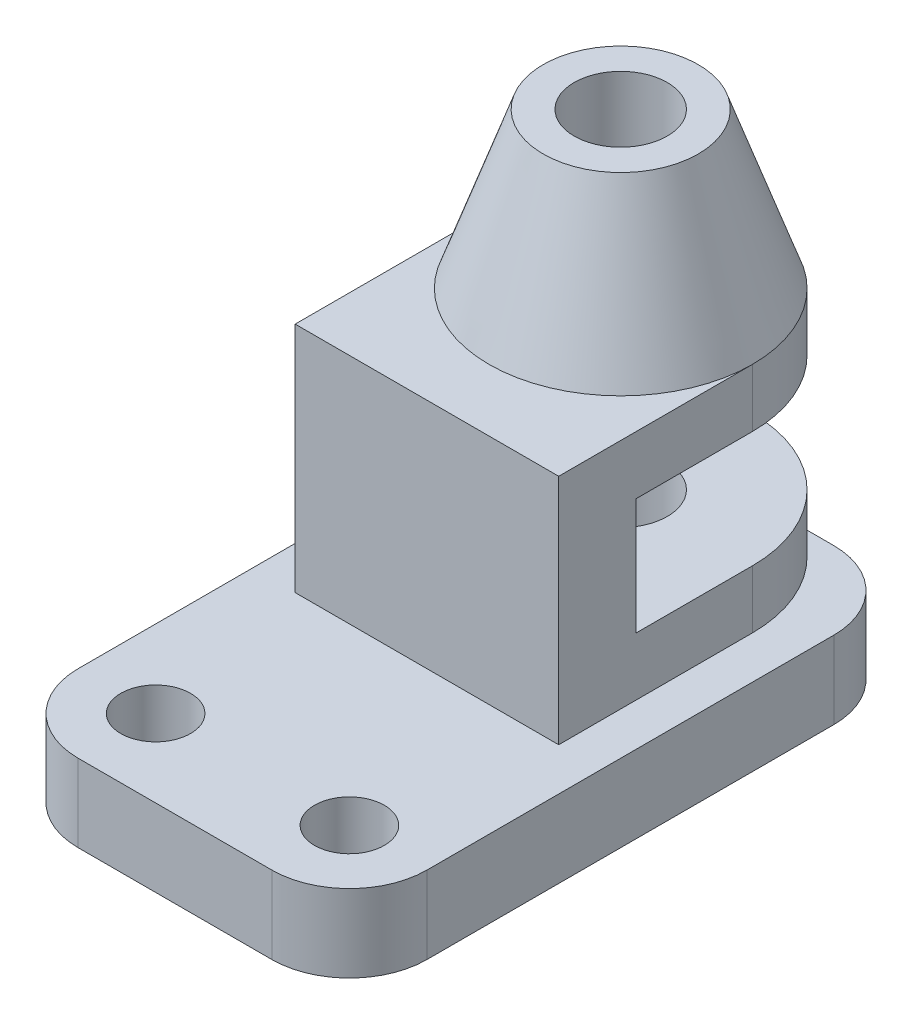
from build123d import *

# Parameters (mm, degrees)
SKETCH1_R           = 9
BOSS_EXTRUDE1_DEPTH = 20
BOSS_EXTRUDE4_DEPTH = 60
CUT_EXTRUDE1_START  = -45
CUT_EXTRUDE1_DEPTH  = 30
SKETCH9_R           = 12
CUT_EXTRUDE2_DEPTH  = 150.255653159


with BuildPart() as part:
    # Sketch1 → Boss-Extrude1 (new body)
    with BuildSketch(Plane(origin=(0, 0, 0), x_dir=(1, 0, 0), z_dir=(0, 1, 0))):
        with BuildLine():
            Line((-25, -72.5), (25, -72.5))
            ThreePointArc((25, -72.5), (39.142135624, -66.642135624), (45, -52.5))
            Line((45, -52.5), (45, 52.5))
            ThreePointArc((45, 52.5), (39.142135624, 66.642135624), (25, 72.5))
            Line((25, 72.5), (-25, 72.5))
            ThreePointArc((-25, 72.5), (-39.142135624, 66.642135624), (-45, 52.5))
            Line((-45, 52.5), (-45, -52.5))
            ThreePointArc((-45, -52.5), (-39.142135624, -66.642135624), (-25, -72.5))
        make_face()
        with Locations(Location((25, -52.5, 0), (0, 0, 270))):
            Circle(SKETCH1_R, mode=Mode.SUBTRACT)
        with Locations(Location((-25, -52.5, 0), (0, 0, 270))):
            Circle(SKETCH1_R, mode=Mode.SUBTRACT)
    extrude(amount=BOSS_EXTRUDE1_DEPTH)

    # Sketch4 → Boss-Extrude4 (add)
    with BuildSketch(Plane(origin=(0, 20, 0), x_dir=(1, 0, 0), z_dir=(0, 1, 0))):
        with BuildLine():
            Line((-34, -7.5), (34, -7.5))
            Line((34, -7.5), (34, 42.5))
            ThreePointArc((34, 42.5), (0, 76.5), (-34, 42.5))
            Line((-34, 42.5), (-34, -7.5))
        make_face()
    extrude(amount=BOSS_EXTRUDE4_DEPTH)

    # Sketch6 → Cut-Extrude1 (cut)
    with BuildSketch(Plane(origin=(0, 80, 0), x_dir=(1, 0, 0), z_dir=(0, 1, 0)).offset(CUT_EXTRUDE1_START)):
        with BuildLine():
            Line((-34, 12.5), (34, 12.5))
            Line((34, 12.5), (34, 42.5))
            ThreePointArc((34, 42.5), (0, 76.5), (-34, 42.5))
            Line((-34, 42.5), (-34, 12.5))
        make_face()
    extrude(amount=CUT_EXTRUDE1_DEPTH, mode=Mode.SUBTRACT)

    # Sketch7 → Revolve1 (revolve)
    with BuildSketch(Plane.XY.offset(-42.5)):
        Polygon((0, 120), (20, 120), (34, 80), (0, 80), align=None)
    revolve(axis=Axis((0, 80, -42.5), (0, 1, 0)))

    # Sketch9 → Cut-Extrude2 (cut, through all)
    with BuildSketch(Plane(origin=(0, 120, 0), x_dir=(1, 0, 0), z_dir=(0, 1, 0))):
        with Locations(Location((0, 42.5, 0), (0, 0, 180))):
            Circle(SKETCH9_R)
    extrude(amount=-CUT_EXTRUDE2_DEPTH, mode=Mode.SUBTRACT)


solid = part.part
